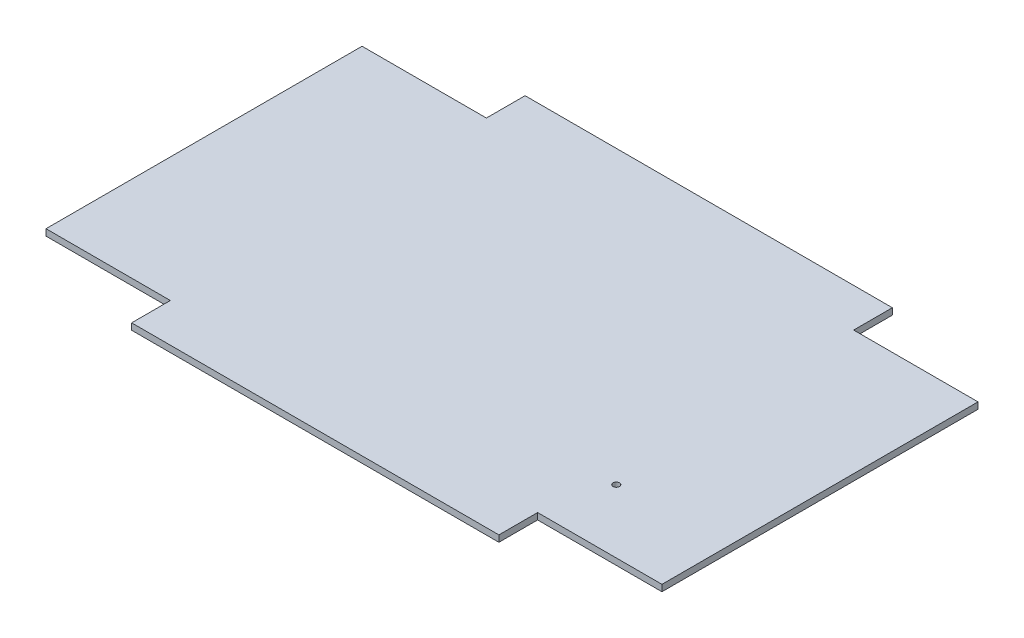
from build123d import *

# Parameters (mm, degrees)
BOSS_EXTRUDE1_DEPTH = 6.35
SKETCH2_R           = 3.175
CUT_EXTRUDE1_DEPTH  = 700.833669971


with BuildPart() as part:
    # Sketch1 → Boss-Extrude1 (new body)
    with BuildSketch(Plane(origin=(0, 0, 0), x_dir=(1, 0, 0), z_dir=(0, 1, 0))):
        Polygon((122.428, 0), (122.428, -38.1), (483.997, -38.1), (483.997, 0), (606.425, 0), (606.425, 311.15), (483.997, 311.15), (483.997, 349.25), (122.428, 349.25), (122.428, 311.15), (0, 311.15), (0, 0), align=None)
    extrude(amount=BOSS_EXTRUDE1_DEPTH)

    # Sketch2 → Cut-Extrude1 (cut, through all)
    with BuildSketch(Plane(origin=(0, 6.35, 0), x_dir=(1, 0, 0), z_dir=(0, 1, 0))):
        with Locations(Location((498.983, 62.484, 0), (0, 0, 270))):
            Circle(SKETCH2_R)
    extrude(amount=-CUT_EXTRUDE1_DEPTH, mode=Mode.SUBTRACT)


solid = part.part
